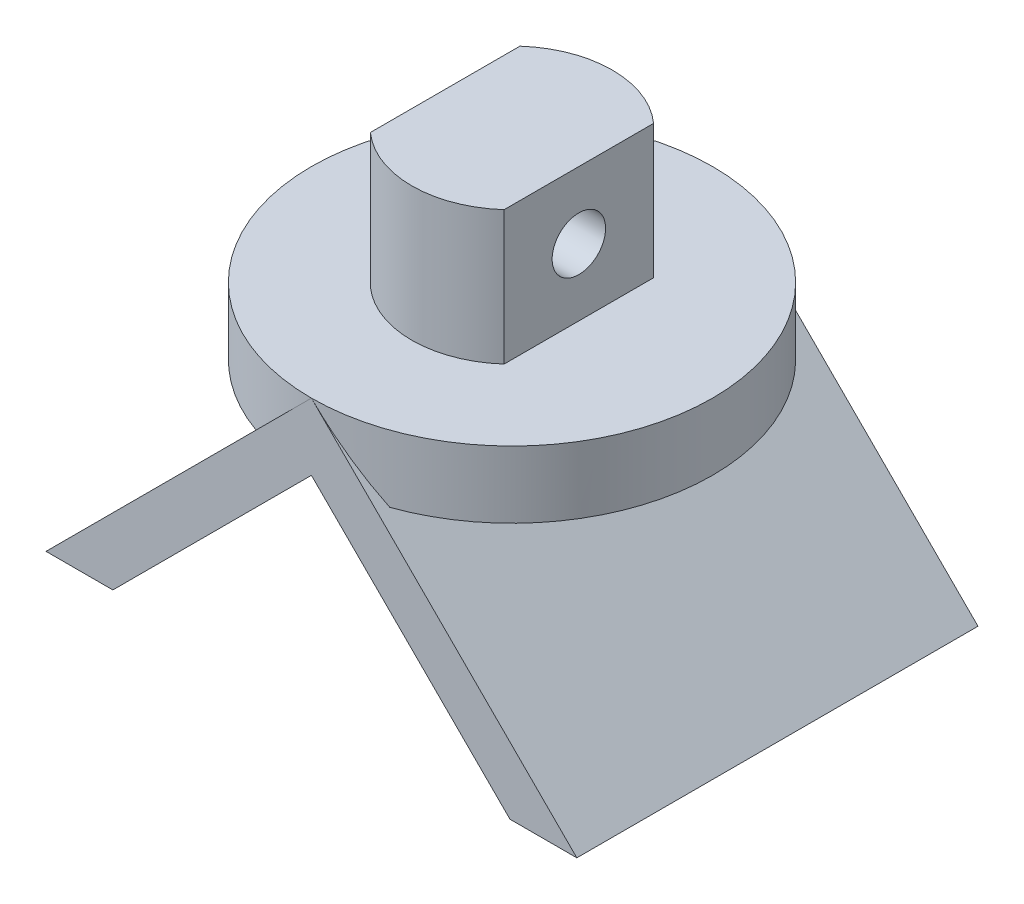
from build123d import *

# Parameters (mm, degrees)
BOSS_EXTRU_1_DEPTH      = 30
ESQUISSE2_R             = 15
BOSS_EXTRU_2_DEPTH      = 5
BOSS_EXTRU_3_DEPTH      = 10
ESQUISSE7_R             = 2
ENL_V_MAT_EXTRU_1_DEPTH = 10


with BuildPart() as part:
    # Esquisse1 → Boss.-Extru.1 (new body)
    with BuildSketch(Plane.XY):
        Polygon((-14.849242405, 0), (0, 14.849242405), (14.849242405, 0), (19.849242405, 0), (0, 19.849242405), (-19.849242405, 0), align=None)
    extrude(amount=BOSS_EXTRU_1_DEPTH)

    # Esquisse2 → Boss.-Extru.2 (add)
    with BuildSketch(Plane(origin=(0, 14.849242405, 0), x_dir=(1, 0, 0), z_dir=(0, 1, 0))):
        with Locations((0, -15)):
            Circle(ESQUISSE2_R)
    extrude(amount=BOSS_EXTRU_2_DEPTH)

    # Esquisse5 → Boss.-Extru.3 (add)
    with BuildSketch(Plane(origin=(0, 19.849242405, 0), x_dir=(1, 0, 0), z_dir=(0, 1, 0))):
        with BuildLine():
            ThreePointArc((5, -9.409830056), (0, -7.5), (-5, -9.409830056))
            Line((-5, -9.409830056), (-5, -15))
            Line((-5, -15), (5, -15))
            Line((5, -15), (5, -9.409830056))
        make_face()
        with BuildLine():
            Line((5, -15), (-5, -15))
            Line((-5, -15), (-5, -20.590169944))
            ThreePointArc((-5, -20.590169944), (0, -22.5), (5, -20.590169944))
            Line((5, -20.590169944), (5, -15))
        make_face()
    extrude(amount=BOSS_EXTRU_3_DEPTH)

    # Esquisse7 → Enlèv. mat.-Extru.1 (cut)
    with BuildSketch(Plane.ZY.offset(5)):
        with Locations((15, 24.849242405)):
            Circle(ESQUISSE7_R)
    extrude(amount=-ENL_V_MAT_EXTRU_1_DEPTH, mode=Mode.SUBTRACT)


solid = part.part
